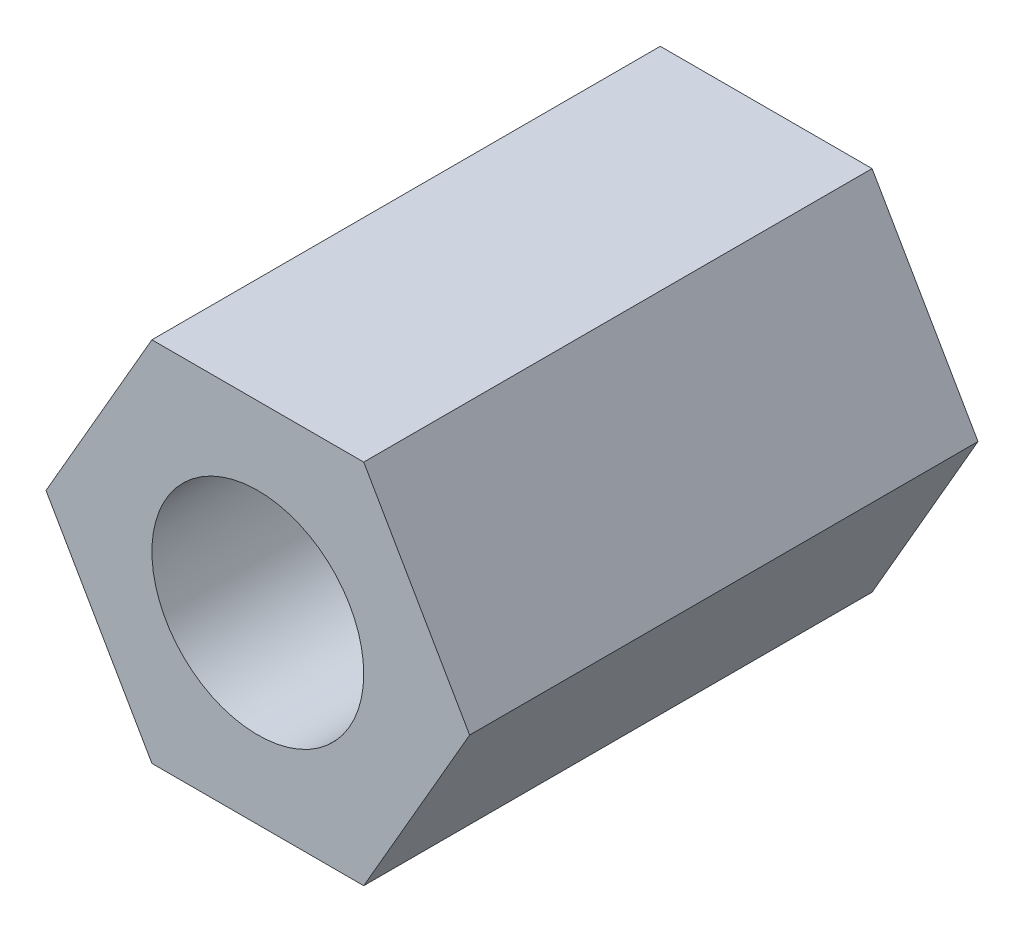
from build123d import *

# Parameters (mm, degrees)
EXTRUDE_1_DEPTH    = 6
HOLE_WIZARD_M3_1_D = 2.5


with BuildPart() as part:
    # 草图1 → 凸台-拉伸1 (new body)
    with BuildSketch(Plane.XY):
        Polygon((0, 0), (2.5, 0), (3.75, -2.165063509), (2.5, -4.330127019), (0, -4.330127019), (-1.25, -2.165063509), align=None)
    extrude(amount=EXTRUDE_1_DEPTH)

    # M3 螺纹孔1 (through all)
    with Locations(Plane.XY.offset(6)):
        with Locations((1.25, -2.165063509)):
            Hole(HOLE_WIZARD_M3_1_D / 2)


solid = part.part
